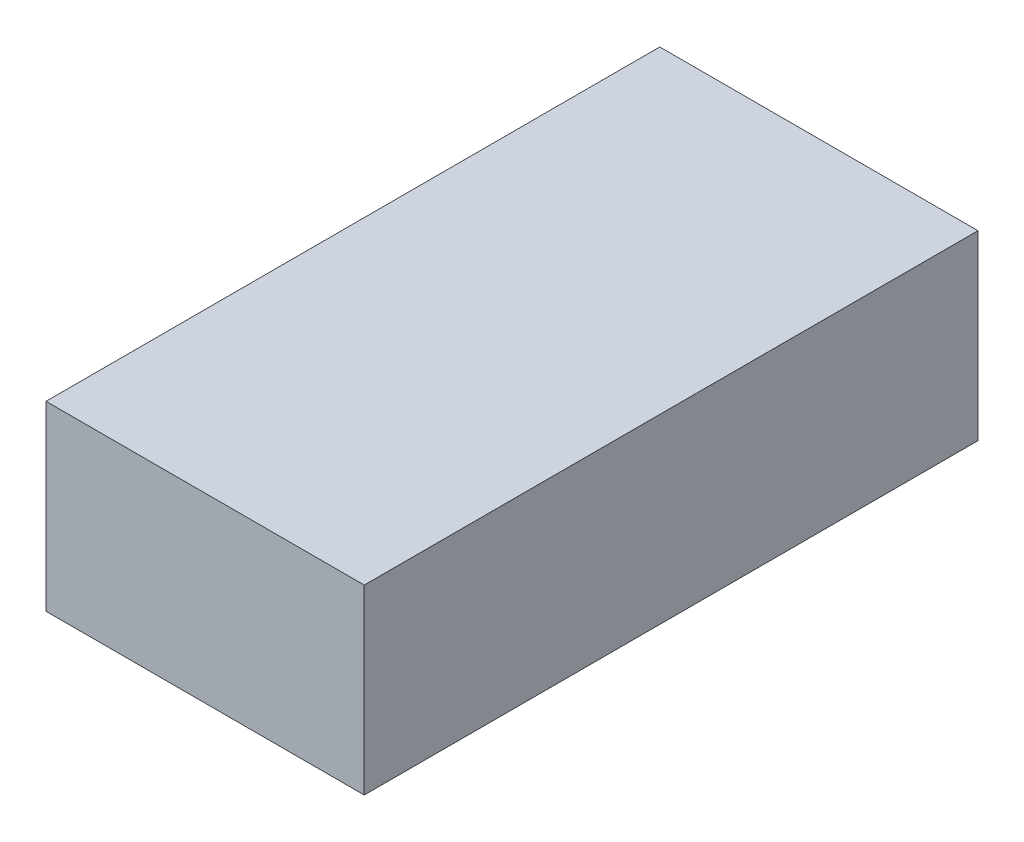
from build123d import *

# Parameters (mm, degrees)
SKETCH1_W           = 44.45
SKETCH1_H           = 85.725
BOSS_EXTRUDE1_DEPTH = 25.4


with BuildPart() as part:
    # Sketch1 → Boss-Extrude1 (new body)
    with BuildSketch(Plane(origin=(0, 0, 0), x_dir=(1, 0, 0), z_dir=(0, 1, 0))):
        Rectangle(SKETCH1_W, SKETCH1_H)
    extrude(amount=BOSS_EXTRUDE1_DEPTH)


solid = part.part
